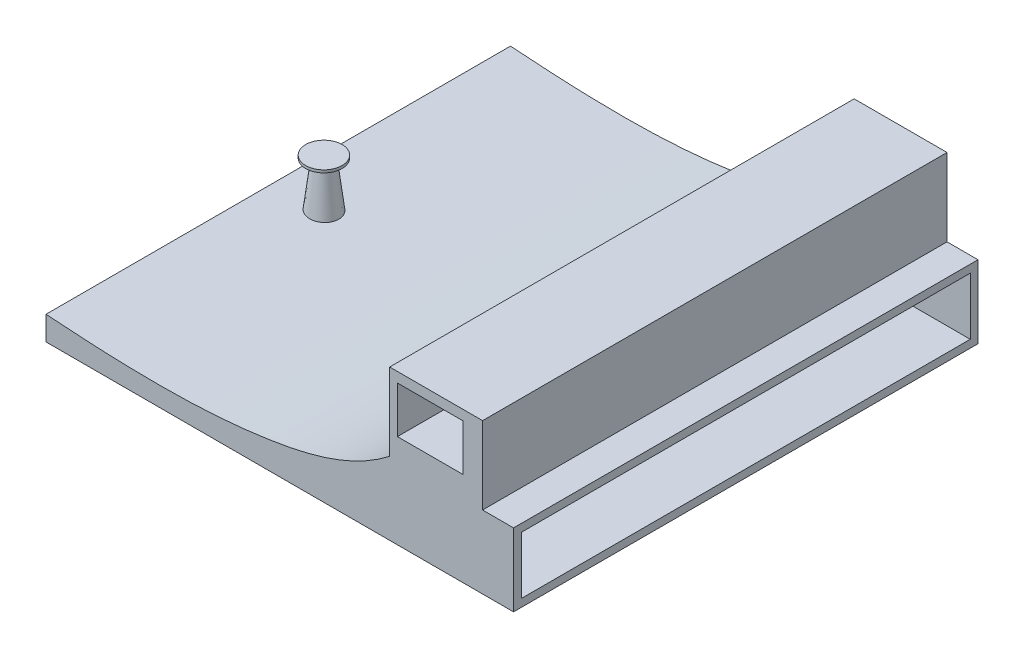
from build123d import *

# Parameters (mm, degrees)
SKETCH1_W           = 49.4
SKETCH1_H           = 140
BOSS_EXTRUDE1_DEPTH = 10
BOSS_EXTRUDE3_DEPTH = 30
SKETCH25_W          = 60
SKETCH25_H          = 9.4
BOSS_EXTRUDE4_DEPTH = 11
SHELL1_T            = -1
SKETCH34_W          = 12
SKETCH34_H          = 60
BOSS_EXTRUDE5_DEPTH = 10
SKETCH38_W          = 8.5
SKETCH38_H          = 6
CUT_EXTRUDE3_DEPTH  = 71.530064661


with BuildPart() as part:
    # Sketch1 → Boss-Extrude1 (new, symmetric)
    with BuildSketch(Plane(origin=(0, 0, 0), x_dir=(1, 0, 0), z_dir=(0, 1, 0))):
        Rectangle(SKETCH1_W, SKETCH1_H)
    extrude(amount=BOSS_EXTRUDE1_DEPTH, both=True)


with BuildPart() as body_2:
    # Sketch5 → Boss-Extrude3 (new, symmetric)
    with BuildSketch(Plane.XY):
        with BuildLine():
            Line((24.7, 0), (24.7, -9.4))
            Line((24.7, -9.4), (-24.7, -9.4))
            Line((-24.7, -9.4), (-24.7, -6.3))
            add(Edge.make_bspline(
                [(19.7, 0), (15.043437724, -3.574706607), (0.818334702, -7.477752328), (-14.226377906, -7.046455079), (-24.7, -6.3)],
                knots=[0, 0, 0, 0, 0.353407129, 1, 1, 1, 1], degree=3))
            Line((19.7, 0), (24.7, 0))
        make_face()
    extrude(amount=BOSS_EXTRUDE3_DEPTH, both=True)


with BuildPart() as part_1:
    add(part.part)

    # Combine1: intersect body 2
    add(body_2.part, mode=Mode.INTERSECT)

    # Sketch8 → Revolve2 (revolve)
    with BuildSketch(Plane.XY):
        with BuildLine():
            Line((-20.8, -7.364032413), (-20.06367715, -1.36716404))
            ThreePointArc((-20.06367715, -1.36716404), (-20.111122975, -1.085879422), (-20.30465694, -0.876316193))
            Line((-20.30465694, -0.876316193), (-21.150764231, -0.876316193))
            Line((-21.150764231, -0.876316193), (-21.150764231, -0.535859851))
            Line((-21.150764231, -0.535859851), (-18.8, -0.535859851))
            Line((-18.8, -0.535859851), (-18.8, -0.876316193))
            Line((-18.8, -0.876316193), (-18.8, -7.364032413))
            Line((-18.8, -7.364032413), (-20.8, -7.364032413))
        make_face()
    revolve(axis=Axis((-18.8, -0.876316193, 0), (0, -1, 0)))



with BuildPart() as body_2_2:
    # Sketch25 → Boss-Extrude4 (new body)
    with BuildSketch(Plane(origin=(24.7, 0, 0), x_dir=(0, 0, -1), z_dir=(1, 0, 0))):
        with Locations((0, -4.7)):
            Rectangle(SKETCH25_W, SKETCH25_H)
    extrude(amount=BOSS_EXTRUDE4_DEPTH)

    # Shell1
    shell1_openings = [body_2_2.faces().sort_by_distance(p)[0] for p in [
        (35.7, -4.7, 0),
    ]]
    offset(amount=SHELL1_T, openings=shell1_openings, kind=Kind.INTERSECTION)


with BuildPart() as part_2:
    add(part_1.part)

    add(body_2_2.part)  # Boss-Extrude5 merges body 2 2
    # Sketch34 → Boss-Extrude5 (add)
    with BuildSketch(Plane(origin=(0, 0, 0), x_dir=(1, 0, 0), z_dir=(0, 1, 0))):
        with Locations((25.7, 0)):
            Rectangle(SKETCH34_W, SKETCH34_H)
    extrude(amount=BOSS_EXTRUDE5_DEPTH)

    # Sketch38 → Cut-Extrude3 (cut, through all)
    with BuildSketch(Plane(origin=(0, 0, -30), x_dir=(-1, 0, 0), z_dir=(0, 0, -1))):
        with Locations((-24.948170483, 5.70970961)):
            Rectangle(SKETCH38_W, SKETCH38_H)
    extrude(amount=-CUT_EXTRUDE3_DEPTH, mode=Mode.SUBTRACT)


solid = part_2.part
